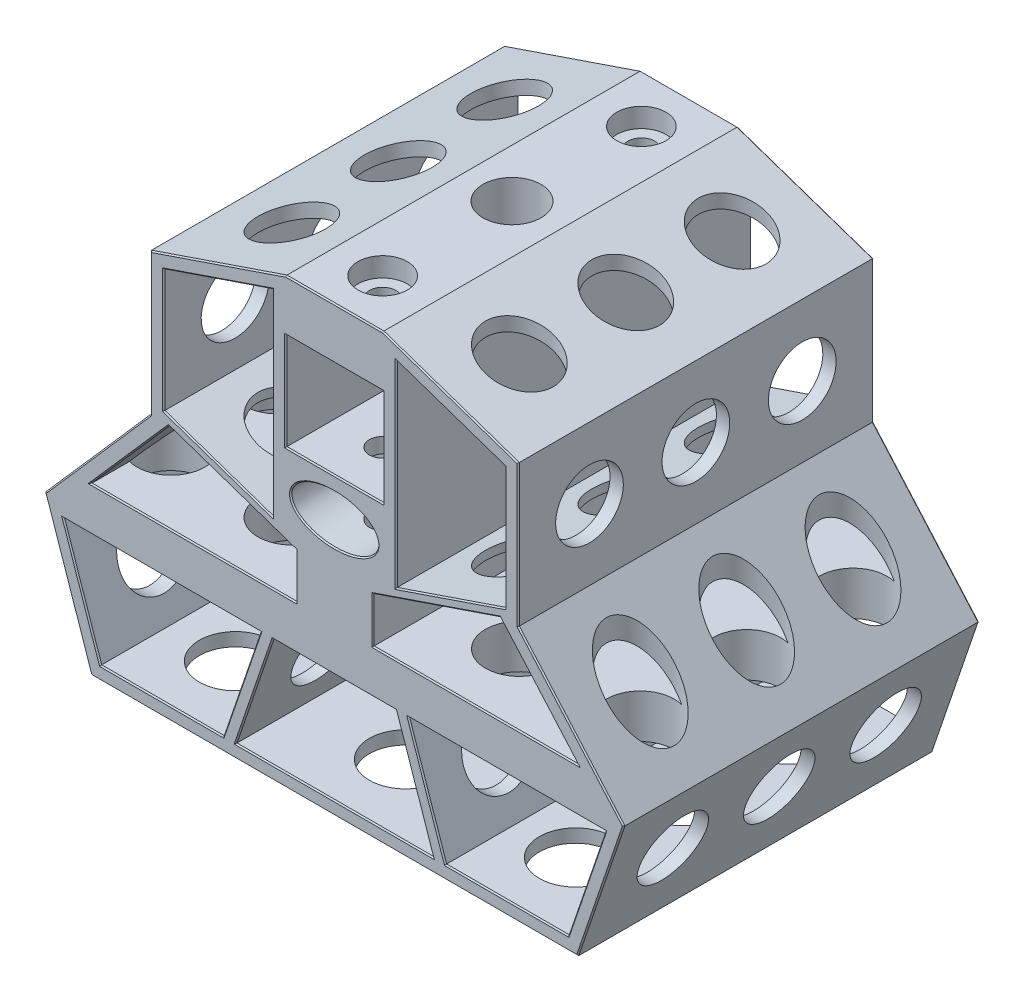
from build123d import *

# Parameters (mm, degrees)
SKETCH1_W                      = 20.045
SKETCH1_H                      = 20.045
BOSS_EXTRUDE1_DEPTH            = 73.5
CUT_EXTRUDE2_DEPTH             = 119.447798608
SKETCH3_RX                     = 9
SKETCH3_RY                     = 5
CUT_EXTRUDE4_DEPTH             = 119.447798608
CUT_EXTRUDE5_DEPTH             = 119.447798781
CUT_EXTRUDE5_DEPTH_BACK        = 119.447798781
SKETCH4_R                      = 7
SKETCH5_R                      = 7
CUT_EXTRUDE6_DEPTH             = 10
CUT_EXTRUDE7_START             = -10
SKETCH6_R                      = 7
CUT_EXTRUDE7_DEPTH             = 10
SKETCH7_R                      = 7.5
CUT_EXTRUDE8_DEPTH             = 10
SKETCH8_R                      = 7
CUT_EXTRUDE9_DEPTH             = 119.447798781
CUT_EXTRUDE9_DIRECTION_2_REACH = 120.448
CUT_EXTRUDE10_REACH            = 133.899
SKETCH9_R                      = 2.75
SKETCH9_R_2                    = 6
SKETCH10_R                     = 5.1
CUT_EXTRUDE11_DEPTH            = 4
CUT_EXTRUDE19_DEPTH            = 119.447798781
CHAMFER1_SIZE                  = 0.25


with BuildPart() as part:
    # Sketch1 → Boss-Extrude1 (new body)
    with BuildSketch(Plane.XY):
        Polygon((59.861803254, -43.0225), (50.316348709, -71.0225), (-50.316348709, -71.0225), (-59.861803254, -43.0225), (-38.0225, -18.146810718), (-38.0225, 11.146810718), (-10.0225, 20.692265263), (0, 20.692265263), (10.0225, 20.692265263), (38.0225, 11.146810718), (38.0225, -18.146810718), align=None)
        Rectangle(SKETCH1_W, SKETCH1_H, mode=Mode.SUBTRACT)
        Polygon((-12.5, -46.0225), (12.5, -46.0225), (20, -68.0225), (-20, -68.0225), align=None, mode=Mode.SUBTRACT)
        Polygon((15.669537991, -46.0225), (23.169537991, -68.0225), (48.169537991, -68.0225), (55.669537991, -46.0225), align=None, mode=Mode.SUBTRACT)
        Polygon((-15.669537991, -46.0225), (-55.669537991, -46.0225), (-48.169537991, -68.0225), (-23.169537991, -68.0225), align=None, mode=Mode.SUBTRACT)
        Polygon((-13.0225, -23.5), (-13.0225, 16.5), (-35.0225, 9), (-35.0225, -16), align=None, mode=Mode.SUBTRACT)
        Polygon((35.0225, 9), (35.0225, -16), (13.0225, -23.5), (13.0225, 16.5), align=None, mode=Mode.SUBTRACT)
    extrude(amount=BOSS_EXTRUDE1_DEPTH)

    # Sketch2 → Cut-Extrude2 (cut, through all)
    with BuildSketch(Plane.XY):
        Polygon((-8, -27.325241236), (-8, -36.712427083), (-50.32983942, -36.712427083), (-34.236093954, -18.381118297), align=None)
        Polygon((8, -27.325241236), (8, -36.712427083), (50.32983942, -36.712427083), (34.236093954, -18.381118297), align=None)
    extrude(amount=CUT_EXTRUDE2_DEPTH, mode=Mode.SUBTRACT)

    # Sketch3 → Cut-Extrude4 (cut, through all)
    with BuildSketch(Plane.XY):
        with Locations((0, -18)):
            Ellipse(SKETCH3_RX, SKETCH3_RY)
    extrude(amount=CUT_EXTRUDE4_DEPTH, mode=Mode.SUBTRACT)

    # Sketch4 → Cut-Extrude5 (cut, two sides: drawn at the far end of the back side and taken through both)
    with BuildSketch(Plane(origin=(0, 0, 0), x_dir=(0, 0, -1), z_dir=(1, 0, 0)).offset(-CUT_EXTRUDE5_DEPTH_BACK)):
        with Locations(Location((-36.75, -56.52, 0), (0, 0, 270))):
            Circle(SKETCH4_R)
        with Locations(Location((-58.75, -56.52, 0), (0, 0, 270))):
            Circle(SKETCH4_R)
        with Locations(Location((-14.75, -56.52, 0), (0, 0, 270))):
            Circle(SKETCH4_R)
    extrude(amount=CUT_EXTRUDE5_DEPTH + CUT_EXTRUDE5_DEPTH_BACK, mode=Mode.SUBTRACT)

    # Sketch5 → Cut-Extrude6 (cut)
    with BuildSketch(Plane(origin=(38.0225, 0, 0), x_dir=(0, 0, -1), z_dir=(1, 0, 0))):
        with Locations(Location((-36.75, -3.5, 0), (0, 0, 90))):
            Circle(SKETCH5_R)
        with Locations(Location((-14.75, -3.5, 0), (0, 0, 90))):
            Circle(SKETCH5_R)
        with Locations(Location((-58.75, -3.5, 0), (0, 0, 90))):
            Circle(SKETCH5_R)
    extrude(amount=-CUT_EXTRUDE6_DEPTH, mode=Mode.SUBTRACT)

    # Sketch6 → Cut-Extrude7 (cut)
    with BuildSketch(Plane.ZY.offset(38.0225).offset(CUT_EXTRUDE7_START)):
        with Locations(Location((36.75, -3.5, 0), (0, 0, 90))):
            Circle(SKETCH6_R)
        with Locations(Location((58.75, -3.5, 0), (0, 0, 90))):
            Circle(SKETCH6_R)
        with Locations(Location((14.75, -3.5, 0), (0, 0, 90))):
            Circle(SKETCH6_R)
    extrude(amount=CUT_EXTRUDE7_DEPTH, mode=Mode.SUBTRACT)

    # Sketch7 → Cut-Extrude8 (cut)
    with BuildSketch(Plane.XZ.offset(71.0225)):
        with Locations((0, 36.75)):
            Circle(SKETCH7_R)
        with Locations((35.16, 36.75)):
            Circle(SKETCH7_R)
        with Locations((-35.16, 36.75)):
            Circle(SKETCH7_R)
        with Locations((0, 58.75)):
            Circle(SKETCH7_R)
        with Locations((35.16, 58.75)):
            Circle(SKETCH7_R)
        with Locations((-35.16, 58.75)):
            Circle(SKETCH7_R)
        with Locations((0, 14.75)):
            Circle(SKETCH7_R)
        with Locations((35.16, 14.75)):
            Circle(SKETCH7_R)
        with Locations((-35.16, 14.75)):
            Circle(SKETCH7_R)
    extrude(amount=-CUT_EXTRUDE8_DEPTH, mode=Mode.SUBTRACT)

    # Sketch8 → Cut-Extrude9 (cut)
    with BuildSketch(Plane(origin=(0, 0, 0), x_dir=(1, 0, 0), z_dir=(0, 1, 0))):
        with Locations(Location((23.52, -36.75, 0), (0, 0, 90))):
            Circle(SKETCH8_R)
        with Locations(Location((23.52, -14.75, 0), (0, 0, 90))):
            Circle(SKETCH8_R)
        with Locations(Location((23.52, -58.75, 0), (0, 0, 90))):
            Circle(SKETCH8_R)
        with Locations(Location((-23.52, -58.75, 0), (0, 0, 90))):
            Circle(SKETCH8_R)
        with Locations(Location((-23.52, -14.75, 0), (0, 0, 90))):
            Circle(SKETCH8_R)
        with Locations(Location((-23.52, -36.75, 0), (0, 0, 90))):
            Circle(SKETCH8_R)
        with Locations((-48.52, -14.75)):
            Circle(SKETCH8_R)
        with Locations((-48.52, -36.75)):
            Circle(SKETCH8_R)
        with Locations((-48.52, -58.75)):
            Circle(SKETCH8_R)
        with Locations((48.52, -14.75)):
            Circle(SKETCH8_R)
        with Locations((48.52, -36.75)):
            Circle(SKETCH8_R)
        with Locations((48.52, -58.75)):
            Circle(SKETCH8_R)
    extrude(amount=CUT_EXTRUDE9_DEPTH, mode=Mode.SUBTRACT)

    # Cut-Extrude9 direction 2: up to this face of the body (flat: up to its plane)
    cut_extrude9_direction_2_end = Plane(part.part.faces().sort_by_distance((35.669537991, -46.0225, 36.75))[0])
    # Sketch8 → Cut-Extrude9 direction 2 (cut, up to the picked face)
    with BuildSketch(Plane(origin=(0, 0, 0), x_dir=(1, 0, 0), z_dir=(0, 1, 0)), mode=Mode.PRIVATE) as cut_extrude9_direction_2_sk1:
        with Locations(Location((23.52, -36.75, 0), (0, 0, 90))):
            Circle(SKETCH8_R)
    cut_extrude9_direction_2_tool1 = split(extrude(cut_extrude9_direction_2_sk1.sketch, amount=-CUT_EXTRUDE9_DIRECTION_2_REACH, mode=Mode.PRIVATE), bisect_by=cut_extrude9_direction_2_end, keep=Keep.BOTH, mode=Mode.PRIVATE)
    # Sketch8 → Cut-Extrude9 direction 2 (cut, up to the picked face)
    with BuildSketch(Plane(origin=(0, 0, 0), x_dir=(1, 0, 0), z_dir=(0, 1, 0)), mode=Mode.PRIVATE) as cut_extrude9_direction_2_sk2:
        with Locations(Location((23.52, -14.75, 0), (0, 0, 90))):
            Circle(SKETCH8_R)
    cut_extrude9_direction_2_tool2 = split(extrude(cut_extrude9_direction_2_sk2.sketch, amount=-CUT_EXTRUDE9_DIRECTION_2_REACH, mode=Mode.PRIVATE), bisect_by=cut_extrude9_direction_2_end, keep=Keep.BOTH, mode=Mode.PRIVATE)
    # Sketch8 → Cut-Extrude9 direction 2 (cut, up to the picked face)
    with BuildSketch(Plane(origin=(0, 0, 0), x_dir=(1, 0, 0), z_dir=(0, 1, 0)), mode=Mode.PRIVATE) as cut_extrude9_direction_2_sk3:
        with Locations(Location((23.52, -58.75, 0), (0, 0, 90))):
            Circle(SKETCH8_R)
    cut_extrude9_direction_2_tool3 = split(extrude(cut_extrude9_direction_2_sk3.sketch, amount=-CUT_EXTRUDE9_DIRECTION_2_REACH, mode=Mode.PRIVATE), bisect_by=cut_extrude9_direction_2_end, keep=Keep.BOTH, mode=Mode.PRIVATE)
    # Sketch8 → Cut-Extrude9 direction 2 (cut, up to the picked face)
    with BuildSketch(Plane(origin=(0, 0, 0), x_dir=(1, 0, 0), z_dir=(0, 1, 0)), mode=Mode.PRIVATE) as cut_extrude9_direction_2_sk4:
        with Locations(Location((-23.52, -58.75, 0), (0, 0, 90))):
            Circle(SKETCH8_R)
    cut_extrude9_direction_2_tool4 = split(extrude(cut_extrude9_direction_2_sk4.sketch, amount=-CUT_EXTRUDE9_DIRECTION_2_REACH, mode=Mode.PRIVATE), bisect_by=cut_extrude9_direction_2_end, keep=Keep.BOTH, mode=Mode.PRIVATE)
    # Sketch8 → Cut-Extrude9 direction 2 (cut, up to the picked face)
    with BuildSketch(Plane(origin=(0, 0, 0), x_dir=(1, 0, 0), z_dir=(0, 1, 0)), mode=Mode.PRIVATE) as cut_extrude9_direction_2_sk5:
        with Locations(Location((-23.52, -14.75, 0), (0, 0, 90))):
            Circle(SKETCH8_R)
    cut_extrude9_direction_2_tool5 = split(extrude(cut_extrude9_direction_2_sk5.sketch, amount=-CUT_EXTRUDE9_DIRECTION_2_REACH, mode=Mode.PRIVATE), bisect_by=cut_extrude9_direction_2_end, keep=Keep.BOTH, mode=Mode.PRIVATE)
    # Sketch8 → Cut-Extrude9 direction 2 (cut, up to the picked face)
    with BuildSketch(Plane(origin=(0, 0, 0), x_dir=(1, 0, 0), z_dir=(0, 1, 0)), mode=Mode.PRIVATE) as cut_extrude9_direction_2_sk6:
        with Locations(Location((-23.52, -36.75, 0), (0, 0, 90))):
            Circle(SKETCH8_R)
    cut_extrude9_direction_2_tool6 = split(extrude(cut_extrude9_direction_2_sk6.sketch, amount=-CUT_EXTRUDE9_DIRECTION_2_REACH, mode=Mode.PRIVATE), bisect_by=cut_extrude9_direction_2_end, keep=Keep.BOTH, mode=Mode.PRIVATE)
    # Sketch8 → Cut-Extrude9 direction 2 (cut, up to the picked face)
    with BuildSketch(Plane(origin=(0, 0, 0), x_dir=(1, 0, 0), z_dir=(0, 1, 0)), mode=Mode.PRIVATE) as cut_extrude9_direction_2_sk7:
        with Locations((-48.52, -14.75)):
            Circle(SKETCH8_R)
    cut_extrude9_direction_2_tool7 = split(extrude(cut_extrude9_direction_2_sk7.sketch, amount=-CUT_EXTRUDE9_DIRECTION_2_REACH, mode=Mode.PRIVATE), bisect_by=cut_extrude9_direction_2_end, keep=Keep.BOTH, mode=Mode.PRIVATE)
    # Sketch8 → Cut-Extrude9 direction 2 (cut, up to the picked face)
    with BuildSketch(Plane(origin=(0, 0, 0), x_dir=(1, 0, 0), z_dir=(0, 1, 0)), mode=Mode.PRIVATE) as cut_extrude9_direction_2_sk8:
        with Locations((-48.52, -36.75)):
            Circle(SKETCH8_R)
    cut_extrude9_direction_2_tool8 = split(extrude(cut_extrude9_direction_2_sk8.sketch, amount=-CUT_EXTRUDE9_DIRECTION_2_REACH, mode=Mode.PRIVATE), bisect_by=cut_extrude9_direction_2_end, keep=Keep.BOTH, mode=Mode.PRIVATE)
    # Sketch8 → Cut-Extrude9 direction 2 (cut, up to the picked face)
    with BuildSketch(Plane(origin=(0, 0, 0), x_dir=(1, 0, 0), z_dir=(0, 1, 0)), mode=Mode.PRIVATE) as cut_extrude9_direction_2_sk9:
        with Locations((-48.52, -58.75)):
            Circle(SKETCH8_R)
    cut_extrude9_direction_2_tool9 = split(extrude(cut_extrude9_direction_2_sk9.sketch, amount=-CUT_EXTRUDE9_DIRECTION_2_REACH, mode=Mode.PRIVATE), bisect_by=cut_extrude9_direction_2_end, keep=Keep.BOTH, mode=Mode.PRIVATE)
    # Sketch8 → Cut-Extrude9 direction 2 (cut, up to the picked face)
    with BuildSketch(Plane(origin=(0, 0, 0), x_dir=(1, 0, 0), z_dir=(0, 1, 0)), mode=Mode.PRIVATE) as cut_extrude9_direction_2_sk10:
        with Locations((48.52, -14.75)):
            Circle(SKETCH8_R)
    cut_extrude9_direction_2_tool10 = split(extrude(cut_extrude9_direction_2_sk10.sketch, amount=-CUT_EXTRUDE9_DIRECTION_2_REACH, mode=Mode.PRIVATE), bisect_by=cut_extrude9_direction_2_end, keep=Keep.BOTH, mode=Mode.PRIVATE)
    # Sketch8 → Cut-Extrude9 direction 2 (cut, up to the picked face)
    with BuildSketch(Plane(origin=(0, 0, 0), x_dir=(1, 0, 0), z_dir=(0, 1, 0)), mode=Mode.PRIVATE) as cut_extrude9_direction_2_sk11:
        with Locations((48.52, -36.75)):
            Circle(SKETCH8_R)
    cut_extrude9_direction_2_tool11 = split(extrude(cut_extrude9_direction_2_sk11.sketch, amount=-CUT_EXTRUDE9_DIRECTION_2_REACH, mode=Mode.PRIVATE), bisect_by=cut_extrude9_direction_2_end, keep=Keep.BOTH, mode=Mode.PRIVATE)
    # Sketch8 → Cut-Extrude9 direction 2 (cut, up to the picked face)
    with BuildSketch(Plane(origin=(0, 0, 0), x_dir=(1, 0, 0), z_dir=(0, 1, 0)), mode=Mode.PRIVATE) as cut_extrude9_direction_2_sk12:
        with Locations((48.52, -58.75)):
            Circle(SKETCH8_R)
    cut_extrude9_direction_2_tool12 = split(extrude(cut_extrude9_direction_2_sk12.sketch, amount=-CUT_EXTRUDE9_DIRECTION_2_REACH, mode=Mode.PRIVATE), bisect_by=cut_extrude9_direction_2_end, keep=Keep.BOTH, mode=Mode.PRIVATE)
    add(cut_extrude9_direction_2_tool1.solids().sort_by(Axis((23.52, 0, 36.75), (0, -1, 0)))[0], mode=Mode.SUBTRACT)
    add(cut_extrude9_direction_2_tool2.solids().sort_by(Axis((23.52, 0, 14.75), (0, -1, 0)))[0], mode=Mode.SUBTRACT)
    add(cut_extrude9_direction_2_tool3.solids().sort_by(Axis((23.52, 0, 58.75), (0, -1, 0)))[0], mode=Mode.SUBTRACT)
    add(cut_extrude9_direction_2_tool4.solids().sort_by(Axis((-23.52, 0, 58.75), (0, -1, 0)))[0], mode=Mode.SUBTRACT)
    add(cut_extrude9_direction_2_tool5.solids().sort_by(Axis((-23.52, 0, 14.75), (0, -1, 0)))[0], mode=Mode.SUBTRACT)
    add(cut_extrude9_direction_2_tool6.solids().sort_by(Axis((-23.52, 0, 36.75), (0, -1, 0)))[0], mode=Mode.SUBTRACT)
    add(cut_extrude9_direction_2_tool7.solids().sort_by(Axis((-48.52, 0, 14.75), (0, -1, 0)))[0], mode=Mode.SUBTRACT)
    add(cut_extrude9_direction_2_tool8.solids().sort_by(Axis((-48.52, 0, 36.75), (0, -1, 0)))[0], mode=Mode.SUBTRACT)
    add(cut_extrude9_direction_2_tool9.solids().sort_by(Axis((-48.52, 0, 58.75), (0, -1, 0)))[0], mode=Mode.SUBTRACT)
    add(cut_extrude9_direction_2_tool10.solids().sort_by(Axis((48.52, 0, 14.75), (0, -1, 0)))[0], mode=Mode.SUBTRACT)
    add(cut_extrude9_direction_2_tool11.solids().sort_by(Axis((48.52, 0, 36.75), (0, -1, 0)))[0], mode=Mode.SUBTRACT)
    add(cut_extrude9_direction_2_tool12.solids().sort_by(Axis((48.52, 0, 58.75), (0, -1, 0)))[0], mode=Mode.SUBTRACT)

    # Cut-Extrude10: up to this face of the body (flat: up to its plane)
    cut_extrude10_end = Plane(part.part.faces().sort_by_distance((0, -46.0225, 36.75))[0])
    # Sketch9 → Cut-Extrude10 (cut, up to the picked face)
    with BuildSketch(Plane(origin=(0, 20.692265263, 0), x_dir=(1, 0, 0), z_dir=(0, 1, 0)), mode=Mode.PRIVATE) as cut_extrude10_sk1:
        with Locations(Location((0, -10, 0), (0, 0, 180))):
            Circle(SKETCH9_R)
    cut_extrude10_tool1 = split(extrude(cut_extrude10_sk1.sketch, amount=-CUT_EXTRUDE10_REACH, mode=Mode.PRIVATE), bisect_by=cut_extrude10_end, keep=Keep.BOTH, mode=Mode.PRIVATE)
    # Sketch9 → Cut-Extrude10 (cut, up to the picked face)
    with BuildSketch(Plane(origin=(0, 20.692265263, 0), x_dir=(1, 0, 0), z_dir=(0, 1, 0)), mode=Mode.PRIVATE) as cut_extrude10_sk2:
        with Locations(Location((0, -63.5, 0), (0, 0, 180))):
            Circle(SKETCH9_R)
    cut_extrude10_tool2 = split(extrude(cut_extrude10_sk2.sketch, amount=-CUT_EXTRUDE10_REACH, mode=Mode.PRIVATE), bisect_by=cut_extrude10_end, keep=Keep.BOTH, mode=Mode.PRIVATE)
    # Sketch9 → Cut-Extrude10 (cut, up to the picked face)
    with BuildSketch(Plane(origin=(0, 20.692265263, 0), x_dir=(1, 0, 0), z_dir=(0, 1, 0)), mode=Mode.PRIVATE) as cut_extrude10_sk3:
        with Locations(Location((0, -36.75, 0), (0, 0, 180))):
            Circle(SKETCH9_R_2)
    cut_extrude10_tool3 = split(extrude(cut_extrude10_sk3.sketch, amount=-CUT_EXTRUDE10_REACH, mode=Mode.PRIVATE), bisect_by=cut_extrude10_end, keep=Keep.BOTH, mode=Mode.PRIVATE)
    add(cut_extrude10_tool1.solids().sort_by(Axis((0, 20.692265, 10), (0, -1, 0)))[0], mode=Mode.SUBTRACT)
    add(cut_extrude10_tool2.solids().sort_by(Axis((0, 20.692265, 63.5), (0, -1, 0)))[0], mode=Mode.SUBTRACT)
    add(cut_extrude10_tool3.solids().sort_by(Axis((0, 20.692265, 36.75), (0, -1, 0)))[0], mode=Mode.SUBTRACT)

    # Sketch10 → Cut-Extrude11 (cut)
    with BuildSketch(Plane(origin=(0, 20.692265263, 0), x_dir=(1, 0, 0), z_dir=(0, 1, 0))):
        with Locations(Location((0, -10, 0), (0, 0, 180))):
            Circle(SKETCH10_R)
        with Locations(Location((0, -63.5, 0), (0, 0, 180))):
            Circle(SKETCH10_R)
    extrude(amount=-CUT_EXTRUDE11_DEPTH, mode=Mode.SUBTRACT)

    # Sketch11 → Cut-Extrude19 (cut, through all)
    with BuildSketch(Plane.XY):
        Polygon((-35.2725, -16.178900893), (-12.7725, -23.849355439), (-12.7725, 16.849355439), (-35.2725, 9.178900893), align=None)
        Polygon((35.2725, 9.178900893), (35.2725, -16.178900893), (12.7725, -23.849355439), (12.7725, 16.849355439), align=None)
        Polygon((15.320182552, -45.7725), (22.990637098, -68.2725), (48.348438884, -68.2725), (56.018893429, -45.7725), align=None)
        Polygon((-20.349355439, -68.2725), (20.349355439, -68.2725), (12.678900893, -45.7725), (-12.678900893, -45.7725), align=None)
        Polygon((-56.018893429, -45.7725), (-48.348438884, -68.2725), (-22.990637098, -68.2725), (-15.320182552, -45.7725), align=None)
    extrude(amount=CUT_EXTRUDE19_DEPTH, mode=Mode.SUBTRACT)

    # Chamfer1
    chamfer1_edges = [part.edges().sort_by_distance(p)[0] for p in [
        (55.089075981, -57.0225, 0),
        (0, -71.0225, 0),
        (-55.089075981, -57.0225, 0),
        (-48.942151627, -30.584655359, 0),
        (-21.118046977, -22.853179767, 0),
        (-42.282966687, -27.54677269, 0),
        (-29.16491971, -36.712427083, 0),
        (-8, -32.01883416, 0),
        (-21.118046977, -22.853179767, 73.5),
        (-42.282966687, -27.54677269, 73.5),
        (-29.16491971, -36.712427083, 73.5),
        (-8, -32.01883416, 73.5),
        (-38.0225, -3.5, 0),
        (24.0225, 15.919537991, 73.5),
        (21.118046977, -22.853179767, 0),
        (8, -32.01883416, 0),
        (29.16491971, -36.712427083, 0),
        (42.282966687, -27.54677269, 0),
        (-24.0225, 15.919537991, 0),
        (21.118046977, -22.853179767, 73.5),
        (8, -32.01883416, 73.5),
        (29.16491971, -36.712427083, 73.5),
        (42.282966687, -27.54677269, 73.5),
        (0, 20.692265263, 0),
        (24.0225, 15.919537991, 0),
        (-8.999939908, -18.01827133, 0),
        (-9, -18, 73.5),
        (38.0225, -3.5, 0),
        (48.942151627, -30.584655359, 0),
        (0, 20.692265263, 73.5),
        (-24.0225, 15.919537991, 73.5),
        (-38.0225, -3.5, 73.5),
        (-10.0225, 0, 0),
        (0, -10.0225, 0),
        (10.0225, 0, 0),
        (-48.942151627, -30.584655359, 73.5),
        (0, 10.0225, 0),
        (-10.0225, 0, 73.5),
        (0, -10.0225, 73.5),
        (10.0225, 0, 73.5),
        (0, 10.0225, 73.5),
        (-55.089075981, -57.0225, 73.5),
        (0, -71.0225, 73.5),
        (55.089075981, -57.0225, 73.5),
        (35.2725, -3.5, 0),
        (24.0225, 13.014128166, 0),
        (12.7725, -3.5, 0),
        (24.0225, -20.014128166, 0),
        (24.0225, 13.014128166, 73.5),
        (12.7725, -3.5, 73.5),
        (24.0225, -20.014128166, 73.5),
        (35.2725, -3.5, 73.5),
        (48.942151627, -30.584655359, 73.5),
        (19.155409825, -57.0225, 0),
        (52.183666157, -57.0225, 0),
        (35.669537991, -68.2725, 0),
        (35.669537991, -45.7725, 0),
        (35.669537991, -45.7725, 73.5),
        (19.155409825, -57.0225, 73.5),
        (35.669537991, -68.2725, 73.5),
        (52.183666157, -57.0225, 73.5),
        (-52.183666157, -57.0225, 0),
        (-19.155409825, -57.0225, 0),
        (-35.669537991, -68.2725, 0),
        (-35.669537991, -45.7725, 0),
        (-35.669537991, -45.7725, 73.5),
        (-52.183666157, -57.0225, 73.5),
        (-35.669537991, -68.2725, 73.5),
        (-19.155409825, -57.0225, 73.5),
        (-16.514128166, -57.0225, 0),
        (16.514128166, -57.0225, 0),
        (0, -68.2725, 0),
        (0, -45.7725, 0),
        (-16.514128166, -57.0225, 73.5),
        (0, -68.2725, 73.5),
        (16.514128166, -57.0225, 73.5),
        (0, -45.7725, 73.5),
        (-35.2725, -3.5, 0),
        (-24.0225, -20.014128166, 0),
        (-12.7725, -3.5, 0),
        (-24.0225, 13.014128166, 0),
        (-35.2725, -3.5, 73.5),
        (-24.0225, -20.014128166, 73.5),
        (-12.7725, -3.5, 73.5),
        (-24.0225, 13.014128166, 73.5),
        (38.0225, -3.5, 73.5),
    ]]
    chamfer(chamfer1_edges, length=CHAMFER1_SIZE)


solid = part.part
